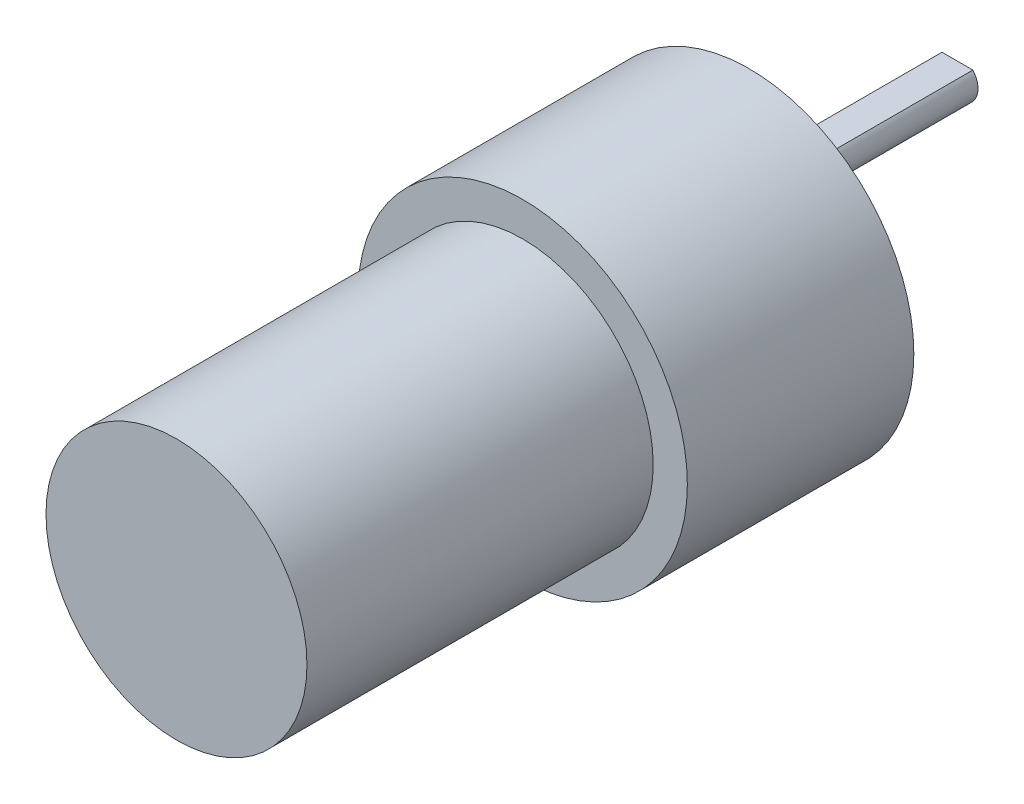
from build123d import *

# Parameters (mm, degrees)
SKETCH4_R           = 3.16
BOSS_EXTRUDE1_DEPTH = 30.5
CUT_EXTRUDE2_START  = -29
CUT_EXTRUDE2_DEPTH  = 29
SKETCH6_R           = 2.375
CUT_EXTRUDE3_DEPTH  = 5


with BuildPart() as part:
    # Sketch1 → Revolve1 (revolve)
    with BuildSketch(Plane(origin=(0, 0, 0), x_dir=(1, 0, 0), z_dir=(0, 1, 0))):
        Polygon((0, 0), (20.05, 0), (20.05, 53.2), (25.3, 53.2), (25.3, 88), (14.25, 88), (14.25, 89.5), (0, 89.5), align=None)
    revolve(axis=Axis((0, 0, 0), (0, 0, -1)))

    # Sketch4 → Boss-Extrude1 (add)
    with BuildSketch(Plane(origin=(0, 0, -89.5), x_dir=(-1, 0, 0), z_dir=(0, 0, -1))):
        with Locations(Location((0, 8.21, 0), (0, 0, 180))):
            Circle(SKETCH4_R)
    extrude(amount=BOSS_EXTRUDE1_DEPTH)

    # Sketch5 → Cut-Extrude2 (cut)
    with BuildSketch(Plane(origin=(0, 0, -120), x_dir=(-1, 0, 0), z_dir=(0, 0, -1)).offset(CUT_EXTRUDE2_START)):
        with BuildLine():
            Line((-2.370126579, 10.3), (2.370126579, 10.3))
            ThreePointArc((2.370126579, 10.3), (0, 11.37), (-2.370126579, 10.3))
        make_face()
    extrude(amount=CUT_EXTRUDE2_DEPTH, mode=Mode.SUBTRACT)

    # Sketch6 → Cut-Extrude3 (cut)
    with BuildSketch(Plane(origin=(0, 0, -88), x_dir=(-1, 0, 0), z_dir=(0, 0, -1))):
        with Locations((-19, 0)):
            Circle(SKETCH6_R)
        with Locations((19, 0)):
            Circle(SKETCH6_R)
    extrude(amount=-CUT_EXTRUDE3_DEPTH, mode=Mode.SUBTRACT)


solid = part.part
